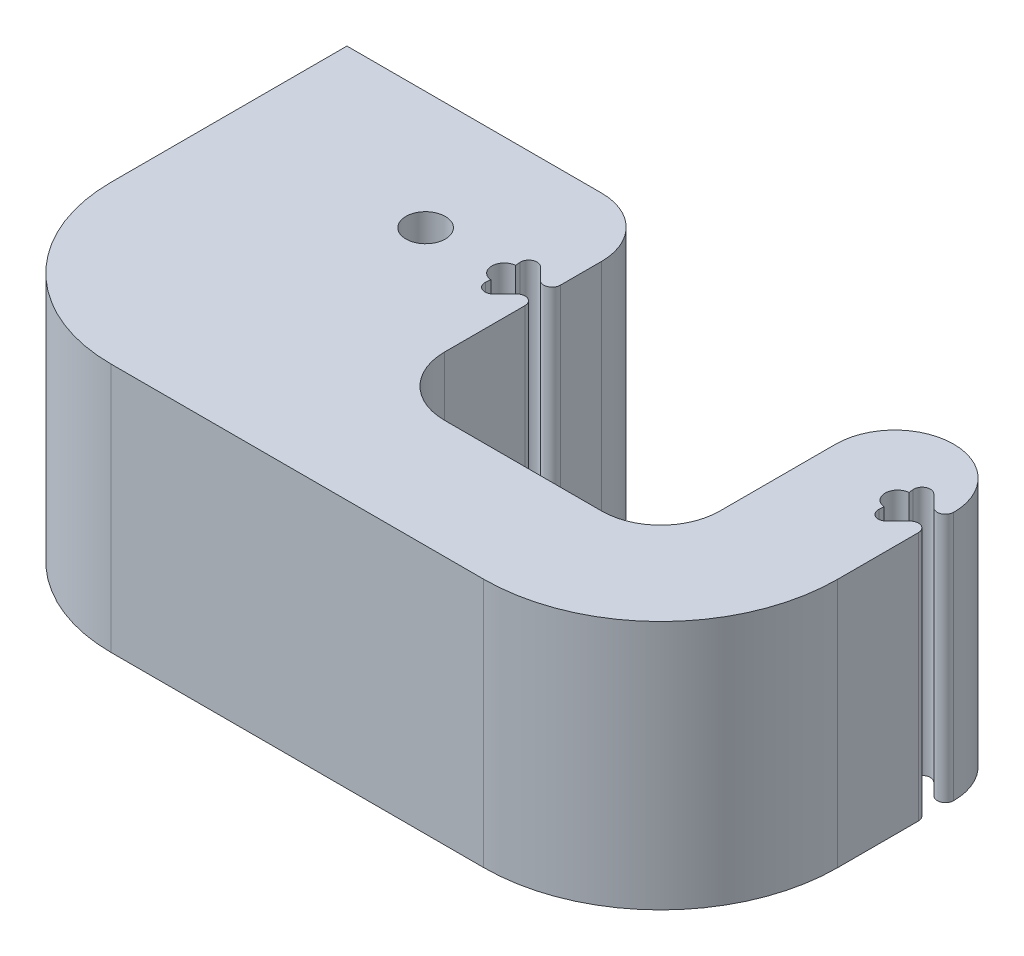
from build123d import *

# Parameters (mm, degrees)
SKETCH1_R           = 1
BOSS_EXTRUDE1_DEPTH = 12.7
SKETCH2_R           = 4
CUT_EXTRUDE1_DEPTH  = 10


with BuildPart() as part:
    # Sketch1 → Boss-Extrude1 (new body)
    with BuildSketch(Plane(origin=(0, 0, 0), x_dir=(1, 0, 0), z_dir=(0, 1, 0))):
        with BuildLine():
            Line((-4.055343897, 0.632583633), (-4.075844459, 0.866906139))
            ThreePointArc((-4.075844459, 0.866906139), (-3.83530083, 1.283539926), (-3.361522369, 1.2))
            Line((-3.361522369, 1.2), (-2.761522369, 0.6))
            ThreePointArc((-2.761522369, 0.6), (-2.304491577, 0.509090923), (-2.04560443, 0.89654292))
            Line((-2.04560443, 0.89654292), (-2.04560443, 3))
            ThreePointArc((-2.04560443, 3), (-2.924284086, 5.121320344), (-5.04560443, 6))
            Line((-5.04560443, 6), (-18, 6))
            Line((-18, 6), (-18, -6))
            ThreePointArc((-18, -6), (-15.656854249, -11.656854249), (-10, -14))
            Line((-10, -14), (8.95439557, -14))
            ThreePointArc((8.95439557, -14), (15.318356601, -11.363961031), (17.95439557, -5))
            Line((17.95439557, -5), (17.95439557, -0.89654292))
            ThreePointArc((17.95439557, -0.89654292), (17.695508423, -0.509090923), (17.238477631, -0.6))
            Line((17.238477631, -0.6), (16.638477631, -1.2))
            ThreePointArc((16.638477631, -1.2), (16.16469917, -1.283539926), (15.924155541, -0.866906139))
            Line((15.924155541, -0.866906139), (15.944656103, -0.632583633))
            ThreePointArc((15.944656103, -0.632583633), (15.365, 0), (15.944656103, 0.632583633))
            Line((15.944656103, 0.632583633), (15.924155541, 0.866906139))
            ThreePointArc((15.924155541, 0.866906139), (16.16469917, 1.283539926), (16.638477631, 1.2))
            Line((16.638477631, 1.2), (17.238477631, 0.6))
            ThreePointArc((17.238477631, 0.6), (17.695508423, 0.509090923), (17.95439557, 0.89654292))
            ThreePointArc((17.95439557, 0.89654292), (14.95439557, 3.89654292), (11.95439557, 0.89654292))
            Line((11.95439557, 0.89654292), (11.95439557, -5))
            ThreePointArc((11.95439557, -5), (11.075715914, -7.121320344), (8.95439557, -8))
            Line((8.95439557, -8), (0.95439557, -8))
            ThreePointArc((0.95439557, -8), (-1.166924773, -7.121320344), (-2.04560443, -5))
            Line((-2.04560443, -5), (-2.04560443, -0.89654292))
            ThreePointArc((-2.04560443, -0.89654292), (-2.304491577, -0.509090923), (-2.761522369, -0.6))
            Line((-2.761522369, -0.6), (-3.361522369, -1.2))
            ThreePointArc((-3.361522369, -1.2), (-3.83530083, -1.283539926), (-4.075844459, -0.866906139))
            Line((-4.075844459, -0.866906139), (-4.055343897, -0.632583633))
            ThreePointArc((-4.055343897, -0.632583633), (-4.635, 0), (-4.055343897, 0.632583633))
        make_face()
        with Locations(Location((-8, 0, 0), (0, 0, 270))):
            Circle(SKETCH1_R, mode=Mode.SUBTRACT)
    extrude(amount=BOSS_EXTRUDE1_DEPTH)

    # Sketch2 → Cut-Extrude1 (cut)
    with BuildSketch(Plane.ZY.offset(18)):
        with Locations((0, 6.35)):
            Circle(SKETCH2_R)
    extrude(amount=-CUT_EXTRUDE1_DEPTH, mode=Mode.SUBTRACT)


solid = part.part
